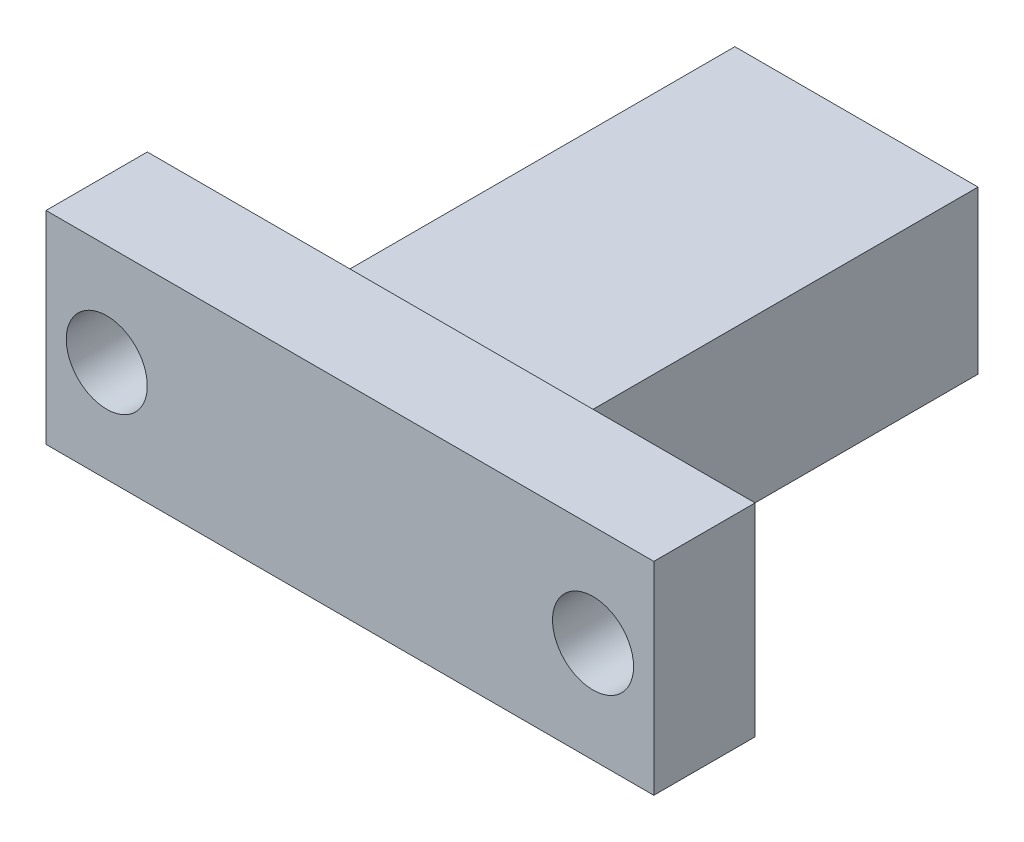
from build123d import *

# Parameters (mm, degrees)
SKETCH1_W           = 30
SKETCH1_H           = 10
SKETCH1_R           = 2
BOSS_EXTRUDE1_DEPTH = 5
SKETCH2_W           = 12
SKETCH2_H           = 8
BOSS_EXTRUDE2_DEPTH = 20
SKETCH3_R           = 5
CUT_EXTRUDE1_DEPTH  = 6


with BuildPart() as part:
    # Sketch1 → Boss-Extrude1 (new body)
    with BuildSketch(Plane.XY):
        Rectangle(SKETCH1_W, SKETCH1_H)
        with Locations((12, 0)):
            Circle(SKETCH1_R, mode=Mode.SUBTRACT)
        with Locations(Location((-12, 0, 0), (0, 0, 180))):
            Circle(SKETCH1_R, mode=Mode.SUBTRACT)
    extrude(amount=BOSS_EXTRUDE1_DEPTH)

    # Sketch2 → Boss-Extrude2 (add)
    with BuildSketch(Plane(origin=(0, 0, 0), x_dir=(-1, 0, 0), z_dir=(0, 0, -1))):
        Rectangle(SKETCH2_W, SKETCH2_H)
    extrude(amount=BOSS_EXTRUDE2_DEPTH)

    # Sketch3 → Cut-Extrude1 (cut)
    with BuildSketch(Plane(origin=(-5, -5, 0), x_dir=(-0.7071067811865477, 0.7071067811865475, 0), z_dir=(-0.7071067811865475, -0.7071067811865477, 0))):
        with Locations(Location((1.414213562, 10, 0), (0, 0, 180))):
            Circle(SKETCH3_R)
    extrude(amount=-CUT_EXTRUDE1_DEPTH, mode=Mode.SUBTRACT)


solid = part.part
